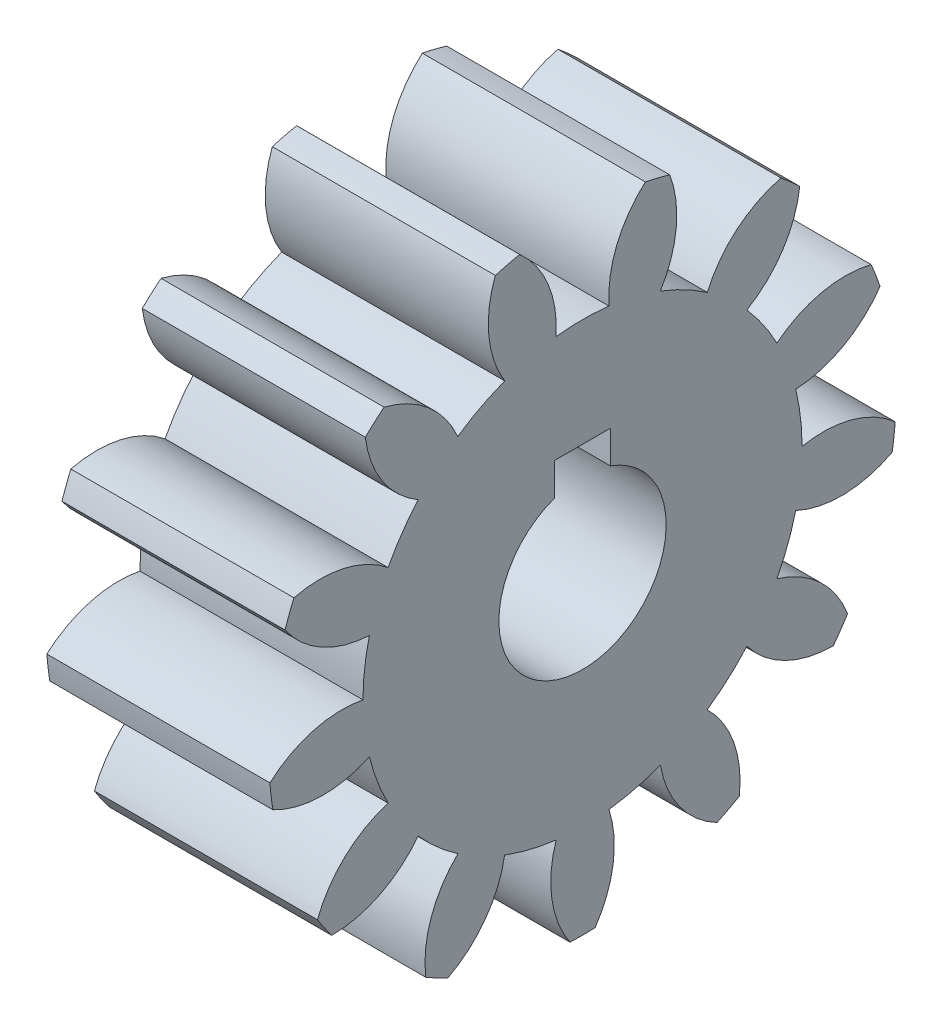
from build123d import *

# Parameters (mm, degrees)
BASPROSKE_W     = 8
BASPROSKE_H     = 11.25
TOOTHCUT_DEPTH  = 18.808003819
TEETHCUTS_COUNT = 13
TEETHCUTS_ANGLE = 332.307692308
BORSKE_R        = 3
BORE_DEPTH      = 50.0000508
KEYSKE_W        = 2
KEYSKE_H        = 4
KEYWAY_DEPTH    = 50.0000508


with BuildPart() as part:
    # BasProSke → Base-Revolve (revolve)
    with BuildSketch(Plane(origin=(0, 0, 0), x_dir=(1, 0, 0), z_dir=(0, 1, 0)), mode=Mode.PRIVATE) as base_revolve_sk:
        with Locations((4, 5.625)):
            Rectangle(BASPROSKE_W, BASPROSKE_H)
    revolve(base_revolve_sk.sketch.rotate(Axis((-10, 0, 0), (1, 0, 0)), 180), axis=Axis((-10, 0, 0), (1, 0, 0)))

    # TooCutSke → ToothCut (cut, through all)
    with BuildSketch(Plane(origin=(0, 0, 0), x_dir=(0, 0, -1), z_dir=(1, 0, 0))):
        with BuildLine():
            ThreePointArc((0.95135711, 7.81631599), (0, 7.874), (-0.95135711, 7.81631599))
            ThreePointArc((-0.95135711, 7.81631599), (-1.233506032, 9.58619675), (-2.277442519, 11.043002342))
            ThreePointArc((-2.277442519, 11.043002342), (0, 11.2754), (2.277442519, 11.043002342))
            ThreePointArc((2.277442519, 11.043002342), (1.233506032, 9.58619675), (0.95135711, 7.81631599))
        make_face()
    toothcut = extrude(amount=TOOTHCUT_DEPTH, mode=Mode.SUBTRACT)

    # TeethCuts: ToothCut ×13 about axis
    teethcuts_axis = Axis((-10, 0, 0), (1, 0, 0))
    for i in range(1, TEETHCUTS_COUNT):
        add(toothcut.rotate(teethcuts_axis, i * TEETHCUTS_ANGLE / (TEETHCUTS_COUNT - 1)), mode=Mode.SUBTRACT)

    # BorSke → Bore (cut, symmetric)
    with BuildSketch(Plane(origin=(0, 0, 0), x_dir=(0, 0, -1), z_dir=(1, 0, 0))):
        with Locations(Location((0, 0, 0), (0, 0, 180))):
            Circle(BORSKE_R)
    extrude(amount=BORE_DEPTH, both=True, mode=Mode.SUBTRACT)

    # KeySke → Keyway (cut, symmetric)
    with BuildSketch(Plane(origin=(0, 0, 0), x_dir=(0, 0, -1), z_dir=(1, 0, 0))):
        with Locations((0, 2)):
            Rectangle(KEYSKE_W, KEYSKE_H)
    extrude(amount=KEYWAY_DEPTH, both=True, mode=Mode.SUBTRACT)


solid = part.part
